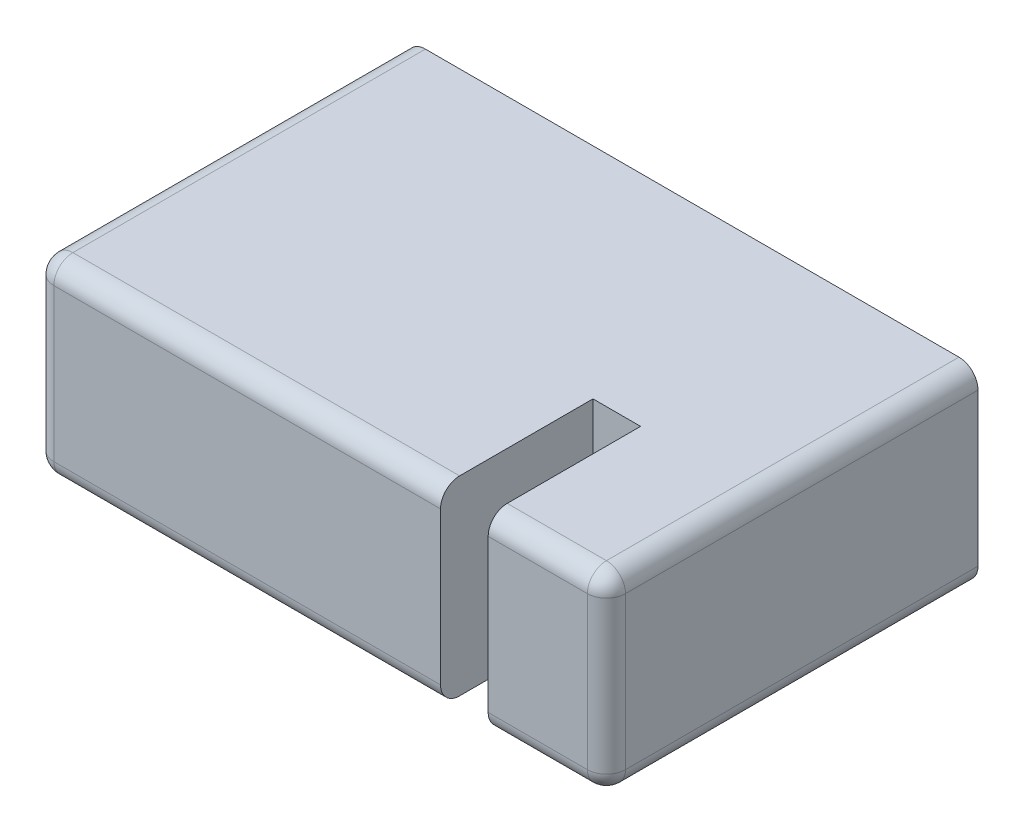
from build123d import *

# Parameters (mm, degrees)
SKETCH1_W                  = 76.2
SKETCH1_H                  = 25.4
EXTRUDE1_DEPTH             = 49.53
SKETCH2_W                  = 6.35
SKETCH2_H                  = 20.32
EXTRUDE2_DEPTH             = 95.36535858
FILLET1_R                  = 2.54
F_10_32_TAPPED_HOLE1_D     = 4.0386
F_10_32_TAPPED_HOLE1_DEPTH = 13.6144
F_10_32_TAPPED_HOLE1_TIP   = 1.213317848


with BuildPart() as part:
    # Sketch1 → Extrude1 (new body)
    with BuildSketch(Plane.XY):
        with Locations((38.1, 12.7)):
            Rectangle(SKETCH1_W, SKETCH1_H)
    extrude(amount=EXTRUDE1_DEPTH)

    # Sketch2 → Extrude2 (cut, through all)
    with BuildSketch(Plane.XZ):
        with Locations((57.260871328, 39.37)):
            Rectangle(SKETCH2_W, SKETCH2_H)
    extrude(amount=-EXTRUDE2_DEPTH, mode=Mode.SUBTRACT)

    # Fillet1
    fillet1_edges = [part.edges().sort_by_distance(p)[0] for p in [
        (76.2, 12.7, 49.53),
        (68.317935664, 25.4, 49.53),
        (68.317935664, 0, 49.53),
        (27.042935664, 25.4, 49.53),
        (0, 12.7, 49.53),
        (27.042935664, 0, 49.53),
        (0, 25.4, 24.765),
        (76.2, 25.4, 24.765),
        (76.2, 0, 24.765),
        (0, 0, 24.765),
    ]]
    fillet(fillet1_edges, radius=FILLET1_R)

    # #10-32 Tapped Hole1
    with Locations(Plane(origin=(66.04, 12.7, 0), x_dir=(-1, 0, 0), z_dir=(0, 0, -1))):
        with Locations((0, 0), (46.99, 0)):
            Hole(F_10_32_TAPPED_HOLE1_D / 2, depth=F_10_32_TAPPED_HOLE1_DEPTH)
            with Locations((0, 0, -(F_10_32_TAPPED_HOLE1_DEPTH + F_10_32_TAPPED_HOLE1_TIP / 2))):  # 118° drill point
                Cone(0, F_10_32_TAPPED_HOLE1_D / 2, F_10_32_TAPPED_HOLE1_TIP, mode=Mode.SUBTRACT)


solid = part.part
